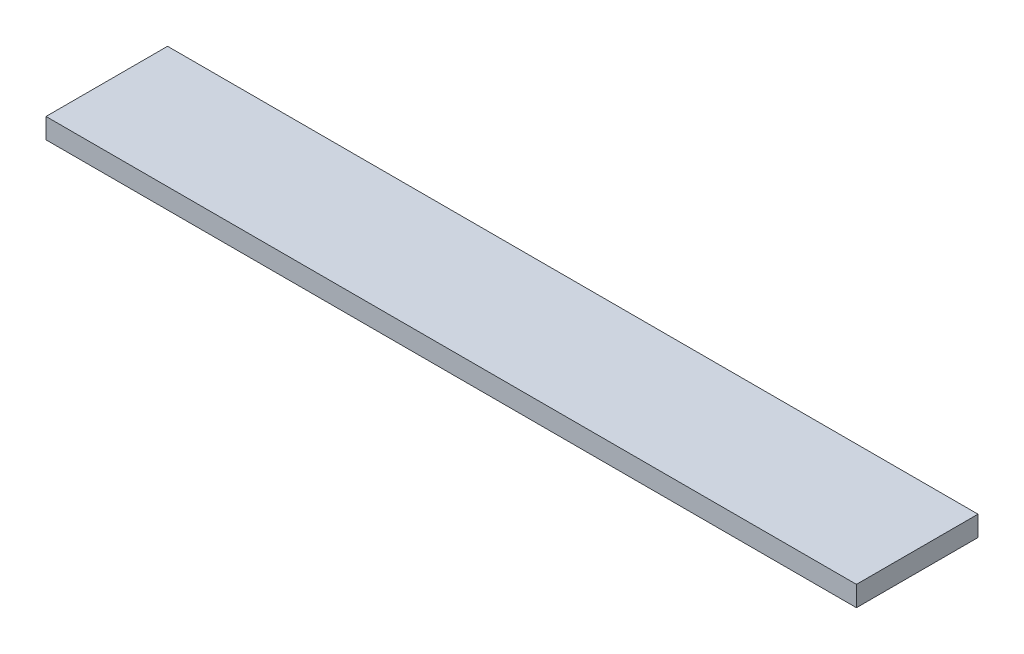
from build123d import *

# Parameters (mm, degrees)
SKETCH1_W           = 152.4
SKETCH1_H           = 25.4
BOSS_EXTRUDE1_DEPTH = 1016


with BuildPart() as part:
    # Sketch1 → Boss-Extrude1 (new body)
    with BuildSketch(Plane(origin=(0, 0, 0), x_dir=(0, 0, -1), z_dir=(1, 0, 0))):
        Rectangle(SKETCH1_W, SKETCH1_H)
    extrude(amount=BOSS_EXTRUDE1_DEPTH)


solid = part.part
